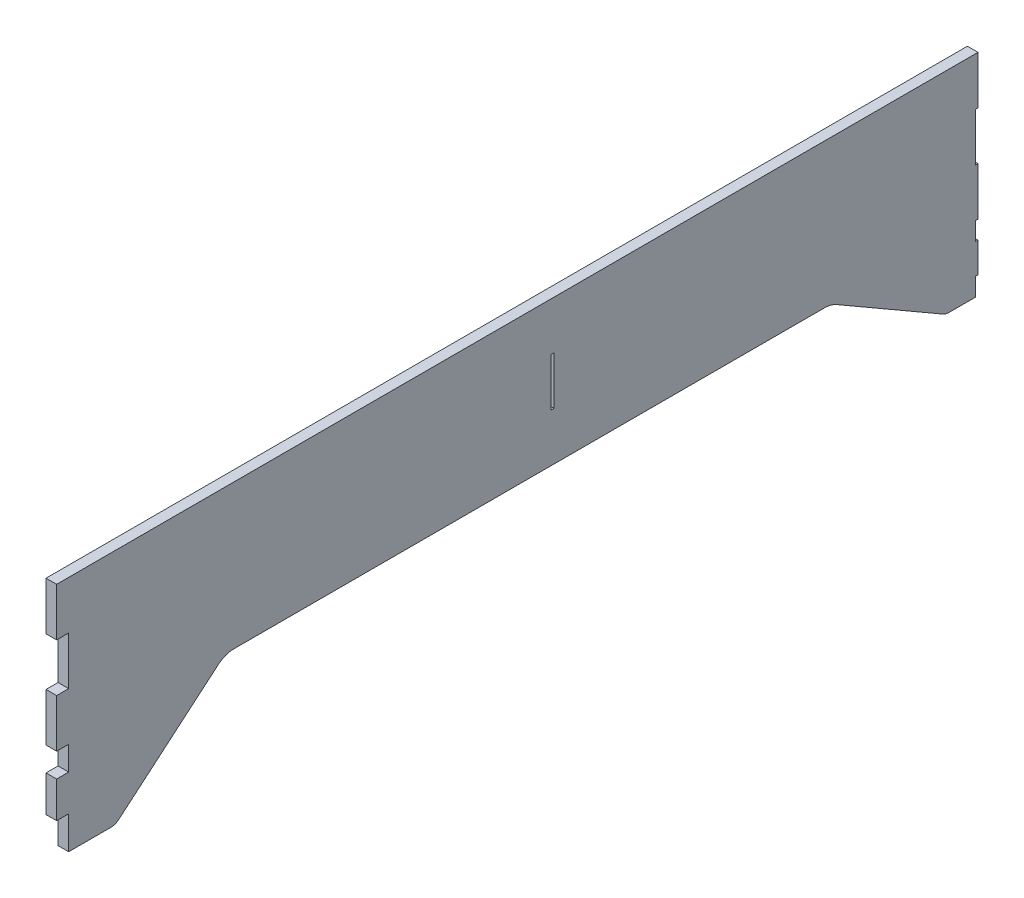
from build123d import *

# Parameters (mm, degrees)
SKETCH1_W           = 25.4
SKETCH1_H           = 1.5875
BOSS_EXTRUDE1_DEPTH = 5.588


with BuildPart() as part:
    # Sketch1 → Boss-Extrude1 (new body)
    # profile 1 of 3: a face of its own
    with BuildSketch(Plane(origin=(-94.488, 0, 0), x_dir=(0, -1, 0), z_dir=(-1, 0, 0))):
        Polygon((136.525, -196.85), (111.125, -196.85), (111.125, -203.2), (85.725, -203.2), (85.725, -196.85), (60.325, -196.85), (60.325, -682.625), (85.725, -682.625), (85.725, -681.325), (111.125, -681.325), (111.125, -682.625), (136.525, -682.625), align=None)
        with Locations((98.425, -458.28125)):
            Rectangle(SKETCH1_W, SKETCH1_H, mode=Mode.SUBTRACT)
    # profile 2 of 3: a face of its own
    with BuildSketch(Plane(origin=(-94.488, 0, 0), x_dir=(0, -1, 0), z_dir=(-1, 0, 0))):
        with BuildLine():
            Line((149.225, -203.2), (136.525, -203.2))
            Line((136.525, -203.2), (136.525, -290.406498707))
            ThreePointArc((136.525, -290.406498707), (137.30121982, -286.034603668), (139.534994681, -282.197126202))
            Line((139.534994681, -282.197126202), (184.118202659, -229.57294303))
            ThreePointArc((184.118202659, -229.57294303), (185.23509009, -227.654204297), (185.6232, -225.468256778))
            Line((185.6232, -225.468256778), (185.6232, -203.2))
            Line((185.6232, -203.2), (168.275, -203.2))
            Line((168.275, -203.2), (168.275, -196.85))
            Line((168.275, -196.85), (149.225, -196.85))
            Line((149.225, -196.85), (149.225, -203.2))
        make_face()
    # profile 3 of 3: a face of its own
    with BuildSketch(Plane(origin=(-94.488, 0, 0), x_dir=(0, -1, 0), z_dir=(-1, 0, 0))):
        with BuildLine():
            ThreePointArc((138.226477372, -608.072045256), (136.957742006, -605.009047129), (136.525, -601.722045256))
            Line((136.525, -601.722045256), (136.525, -681.325))
            Line((136.525, -681.325), (146.05, -681.325))
            Line((146.05, -681.325), (146.05, -682.625))
            Line((146.05, -682.625), (161.925, -682.625))
            Line((161.925, -682.625), (161.925, -681.325))
            Line((161.925, -681.325), (171.45, -681.325))
            Line((171.45, -681.325), (171.45, -667.318351826))
            ThreePointArc((171.45, -667.318351826), (171.233628997, -665.67485089), (170.599261314, -664.143351826))
            Line((170.599261314, -664.143351826), (138.226477372, -608.072045256))
        make_face()
    extrude(amount=-BOSS_EXTRUDE1_DEPTH)


solid = part.part
